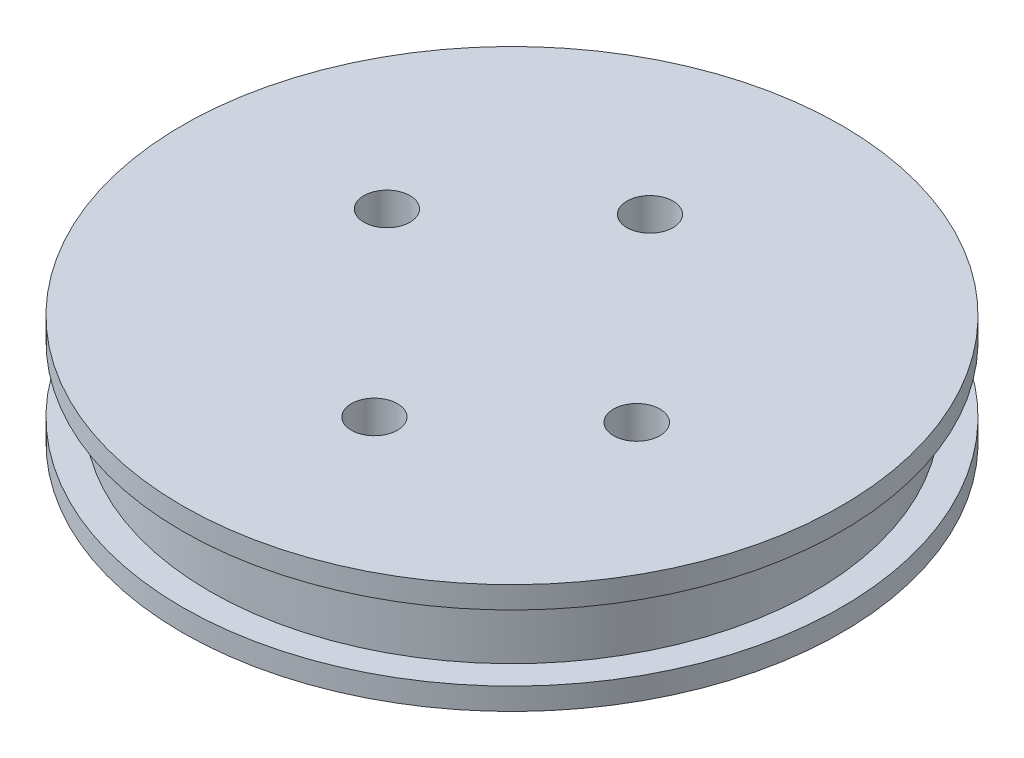
from build123d import *

# Parameters (mm, degrees)
SKETCH_1_R               = 27.5
EXTRUDE_5_DEPTH          = 6
SKETCH_8_R               = 30
EXTRUDE_6_DEPTH          = 2
EXTRUDE_START            = 2
SKETCH_9_R               = 30
EXTRUDE_7_DEPTH          = 2
CUT_EXTRUDE_1_DEPTH      = 44.588989435
CUT_EXTRUDE_1_DEPTH_BACK = 44.588989435
SKETCH_12_R              = 2.11
SKETCH_12_R_2            = 2.1


with BuildPart() as part:
    # Эскиз1 → Бобышка-Вытянуть5 (new body)
    with BuildSketch(Plane(origin=(0, 0, 0), x_dir=(1, 0, 0), z_dir=(0, 1, 0))):
        with Locations(Location((0, 0, 0), (0, 0, 270))):
            Circle(SKETCH_1_R)
    extrude(amount=EXTRUDE_5_DEPTH)

    # Эскиз8 → Бобышка-Вытянуть6 (add)
    with BuildSketch(Plane(origin=(0, 6, 0), x_dir=(1, 0, 0), z_dir=(0, 1, 0))):
        with Locations(Location((0, 0, 0), (0, 0, 270))):
            Circle(SKETCH_8_R)
    extrude(amount=EXTRUDE_6_DEPTH)

    # Эскиз9 → Бобышка-Вытянуть7 (add)
    with BuildSketch(Plane.XZ.offset(EXTRUDE_START)):
        with Locations(Location((0, 0, 0), (0, 0, 90))):
            Circle(SKETCH_9_R)
    extrude(amount=-EXTRUDE_7_DEPTH)

    # Эскиз12 → Вырез-Вытянуть1 (cut, two sides: drawn at the far end of the back side and taken through both)
    with BuildSketch(Plane(origin=(0, 8, 0), x_dir=(1, 0, 0), z_dir=(0, 1, 0)).offset(-CUT_EXTRUDE_1_DEPTH_BACK)):
        with Locations(Location((14.095522252, -2.742507282, 0), (0, 0, 270))):
            Circle(SKETCH_12_R)
        with Locations(Location((1.726848044, -14.255633609, 0), (0, 0, 270))):
            Circle(SKETCH_12_R_2)
        with Locations(Location((-14.100702431, 2.71574754, 0), (0, 0, 270))):
            Circle(SKETCH_12_R_2)
        with Locations(Location((-1.699786223, 14.25888567, 0), (0, 0, 270))):
            Circle(SKETCH_12_R_2)
    extrude(amount=CUT_EXTRUDE_1_DEPTH + CUT_EXTRUDE_1_DEPTH_BACK, mode=Mode.SUBTRACT)


solid = part.part
